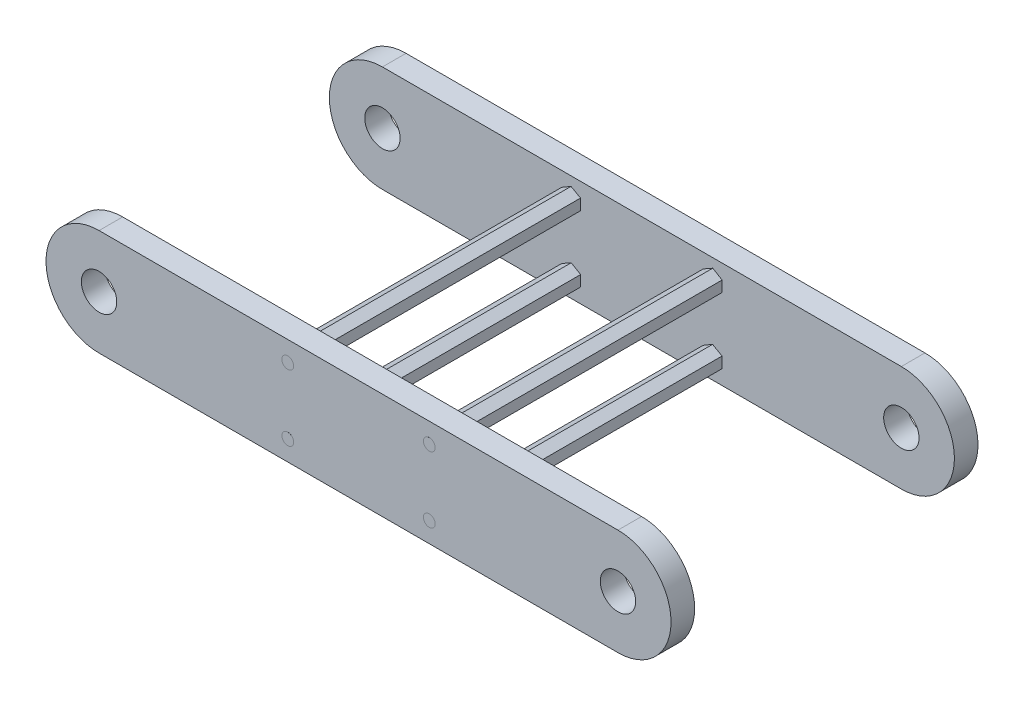
from build123d import *

# Parameters (mm, degrees)
SKETCH1_R             = 7.5
BOSS_EXTRUDE1_DEPTH   = 10
SKETCH2_R             = 2.5
CUT_EXTRUDE1_DEPTH    = 10
BOSS_EXTRUDE3_DEPTH   = 120.14
SKETCH5_R             = 2.5
BOSS_EXTRUDE4_DEPTH   = 10
BOSS_EXTRUDE4_2_DEPTH = 10
BOSS_EXTRUDE4_3_DEPTH = 10
BOSS_EXTRUDE4_4_DEPTH = 10
SKETCH6_R             = 2.5
BOSS_EXTRUDE6_DEPTH   = 10
BOSS_EXTRUDE6_2_DEPTH = 10
BOSS_EXTRUDE6_3_DEPTH = 10
BOSS_EXTRUDE6_4_DEPTH = 10


with BuildPart() as part:
    # Sketch1 → Boss-Extrude1 (new body)
    with BuildSketch(Plane.XY):
        with BuildLine():
            Line((-45, 22.5), (-265, 22.5))
            ThreePointArc((-265, 22.5), (-287.5, 0), (-265, -22.5))
            Line((-265, -22.5), (-45, -22.5))
            ThreePointArc((-45, -22.5), (-22.5, 0), (-45, 22.5))
        make_face()
        with Locations((-45, 0)):
            Circle(SKETCH1_R, mode=Mode.SUBTRACT)
        with Locations((-265, 0)):
            Circle(SKETCH1_R, mode=Mode.SUBTRACT)
    boss_extrude1 = extrude(amount=BOSS_EXTRUDE1_DEPTH)

    # Sketch2 → Cut-Extrude1 (cut)
    with BuildSketch(Plane.XY.offset(10)):
        with Locations((-185, 14)):
            Circle(SKETCH2_R)
        with Locations(Location((-125, 14, 0), (0, 0, 180))):
            Circle(SKETCH2_R)
        with Locations(Location((-185, -14, 0), (0, 0, 180))):
            Circle(SKETCH2_R)
        with Locations((-125, -14)):
            Circle(SKETCH2_R)
    cut_extrude1 = extrude(amount=-CUT_EXTRUDE1_DEPTH, mode=Mode.SUBTRACT)

    # Sketch4 → Boss-Extrude3 (add)
    with BuildSketch(Plane(origin=(0, 0, 0), x_dir=(-1, 0, 0), z_dir=(0, 0, -1))):
        Polygon((129.019187659, 11.724156444), (128.980532164, 16.342796837), (124.961344505, 18.618640394), (120.980812341, 16.275843556), (121.019467836, 11.657203163), (125.038655495, 9.381359606), align=None)
        Polygon((184.961344505, 9.381359606), (180.980812341, 11.724156444), (181.019467836, 16.342796837), (185.038655495, 18.618640394), (189.019187659, 16.275843556), (188.980532164, 11.657203163), align=None)
        Polygon((121.019467836, -11.657203163), (125.038655495, -9.381359606), (129.019187659, -11.724156444), (128.980532164, -16.342796837), (124.961344505, -18.618640394), (120.980812341, -16.275843556), align=None)
        Polygon((180.980812341, -11.724156444), (181.019467836, -16.342796837), (185.038655495, -18.618640394), (189.019187659, -16.275843556), (188.980532164, -11.657203163), (184.961344505, -9.381359606), align=None)
    extrude(amount=BOSS_EXTRUDE3_DEPTH)

    # Mirror6: Boss-Extrude1, Cut-Extrude1 across plane
    add(boss_extrude1.mirror(Plane(origin=(0, 0, -55.07), x_dir=(1, 0, 0), z_dir=(0, 0, -1))))
    add(cut_extrude1.mirror(Plane(origin=(0, 0, -55.07), x_dir=(1, 0, 0), z_dir=(0, 0, -1))), mode=Mode.SUBTRACT)


with BuildPart() as body_2:
    # Sketch5 → Boss-Extrude4 (new body)
    with BuildSketch(Plane.XY):
        with Locations((-125, 14)):
            Circle(SKETCH5_R)
    extrude(amount=BOSS_EXTRUDE4_DEPTH)


with BuildPart() as body_3:
    # Sketch5 → Boss-Extrude4 2 (new body)
    with BuildSketch(Plane.XY):
        with Locations((-185, 14)):
            Circle(SKETCH5_R)
    extrude(amount=BOSS_EXTRUDE4_2_DEPTH)


with BuildPart() as body_4:
    # Sketch5 → Boss-Extrude4 3 (new body)
    with BuildSketch(Plane.XY):
        with Locations((-125, -14)):
            Circle(SKETCH5_R)
    extrude(amount=BOSS_EXTRUDE4_3_DEPTH)


with BuildPart() as body_5:
    # Sketch5 → Boss-Extrude4 4 (new body)
    with BuildSketch(Plane.XY):
        with Locations((-185, -14)):
            Circle(SKETCH5_R)
    extrude(amount=BOSS_EXTRUDE4_4_DEPTH)


with BuildPart() as body_6:
    # Sketch6 → Boss-Extrude6 (new body)
    with BuildSketch(Plane(origin=(0, 0, -110.14), x_dir=(-1, 0, 0), z_dir=(0, 0, -1))):
        with Locations((185, -14)):
            Circle(SKETCH6_R)
    extrude(amount=BOSS_EXTRUDE6_DEPTH)


with BuildPart() as body_7:
    # Sketch6 → Boss-Extrude6 2 (new body)
    with BuildSketch(Plane(origin=(0, 0, -110.14), x_dir=(-1, 0, 0), z_dir=(0, 0, -1))):
        with Locations((185, 14)):
            Circle(SKETCH6_R)
    extrude(amount=BOSS_EXTRUDE6_2_DEPTH)


with BuildPart() as body_8:
    # Sketch6 → Boss-Extrude6 3 (new body)
    with BuildSketch(Plane(origin=(0, 0, -110.14), x_dir=(-1, 0, 0), z_dir=(0, 0, -1))):
        with Locations((125, 14)):
            Circle(SKETCH6_R)
    extrude(amount=BOSS_EXTRUDE6_3_DEPTH)


with BuildPart() as body_9:
    # Sketch6 → Boss-Extrude6 4 (new body)
    with BuildSketch(Plane(origin=(0, 0, -110.14), x_dir=(-1, 0, 0), z_dir=(0, 0, -1))):
        with Locations((125, -14)):
            Circle(SKETCH6_R)
    extrude(amount=BOSS_EXTRUDE6_4_DEPTH)


solid = Compound([part.part, body_2.part, body_3.part, body_4.part, body_5.part, body_6.part, body_7.part, body_8.part, body_9.part])
